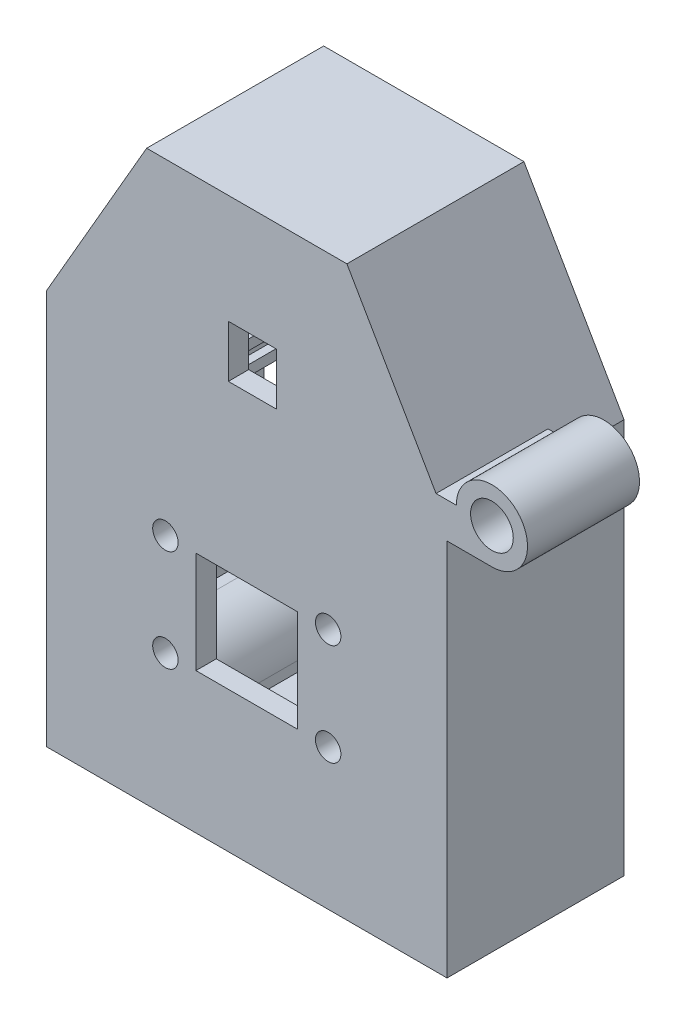
from build123d import *
from build123d.topology import SkipClean

# Parameters (mm, degrees)
BOSS_EXTRUDE1_DEPTH = 22.098
SKETCH11_R          = 1.5875
CUT_EXTRUDE7_DEPTH  = 33.02
CUT_EXTRUDE8_DEPTH  = 2.54
BOSS_EXTRUDE5_DEPTH = 2.54
BOSS_EXTRUDE6_DEPTH = 7.5
SKETCH14_R          = 1.5875
SKETCH14_W          = 12.7
SKETCH14_H          = 12.7
CUT_EXTRUDE9_DEPTH  = 2.54
SKETCH20_W          = 6
SKETCH20_H          = 6.5
CUT_EXTRUDE13_DEPTH = 7.5
SKETCH22_R          = 2.667
BOSS_EXTRUDE7_DEPTH = 13.97999998
SKETCH24_R          = 1.5875
BOSS_EXTRUDE9_DEPTH = 2.54


with BuildPart() as part:
    # Sketch1 → Boss-Extrude1 (new body)
    with BuildSketch(Plane.XY):
        Polygon((-25, 25.4), (-25, -23.909999932), (25, -23.909999932), (25, 25.4), (12.5, 47.050635095), (-12.5, 47.050635095), align=None)
    extrude(amount=BOSS_EXTRUDE1_DEPTH)

    # Sketch11 → Cut-Extrude7 (cut)
    with BuildSketch(Plane.XY.offset(22.098)):
        with BuildLine():
            Line((-18.015, 22.179409051), (-19.92, 22.179409051))
            Line((-19.92, 22.179409051), (-19.92, -11.209999932))
            Line((-19.92, -11.209999932), (-18.65, -11.209999932))
            ThreePointArc((-18.65, -11.209999932), (-14.159871939, -13.069871871), (-12.3, -17.559999932))
            Line((-12.3, -17.559999932), (-12.3, -18.829999932))
            Line((-12.3, -18.829999932), (12.3, -18.829999932))
            Line((12.3, -18.829999932), (12.3, -17.559999932))
            ThreePointArc((12.3, -17.559999932), (14.159871939, -13.069871871), (18.65, -11.209999932))
            Line((18.65, -11.209999932), (19.92, -11.209999932))
            Line((19.92, -11.209999932), (19.92, 24.038818102))
            Line((19.92, 24.038818102), (18.060590949, 27.259409051))
            Line((18.060590949, 27.259409051), (9.567060633, 41.970635095))
            Line((9.567060633, 41.970635095), (-9.567060633, 41.970635095))
            Line((-9.567060633, 41.970635095), (-18.060590949, 27.259409051))
            Line((-18.060590949, 27.259409051), (-18.015, 27.259409051))
            ThreePointArc((-18.015, 27.259409051), (-12.935, 24.719409051), (-18.015, 22.179409051))
        make_face()
        with Locations((-16.11, 24.719409051)):
            Circle(SKETCH11_R)
        with Locations((16.11, -15.02)):
            Circle(SKETCH11_R)
        with Locations((-16.11, -15.02)):
            Circle(SKETCH11_R)
    extrude(amount=-CUT_EXTRUDE7_DEPTH, mode=Mode.SUBTRACT)

    # Sketch12 → Cut-Extrude8 (cut)
    with BuildSketch(Plane(origin=(0, 0, 0), x_dir=(-1, 0, 0), z_dir=(0, 0, -1))):
        Polygon((-22.46, 25.4), (-22.46, -21.369999932), (22.46, -21.369999932), (22.46, 25.4), (11.23, 44.850930569), (-11.23, 44.850930569), align=None)
    extrude(amount=-CUT_EXTRUDE8_DEPTH, mode=Mode.SUBTRACT)

    # Sketch13 → Boss-Extrude5 (add)
    with BuildSketch(Plane.XY.offset(22.098)):
        Polygon((-25, 25.4), (-25, -23.909999932), (25, -23.909999932), (25, 25.4), (12.5, 47.050635095), (-12.5, 47.050635095), align=None)
    extrude(amount=-BOSS_EXTRUDE5_DEPTH)

    # Sketch19 → Boss-Extrude6 (add)
    with BuildSketch(Plane(origin=(0, 0, 19.558), x_dir=(-1, 0, 0), z_dir=(0, 0, -1))):
        Polygon((-11.968279908, 28.961226002), (-11.968279908, 24.921226002), (-9.698279908, 24.921226002), (-9.698279908, 26.191226002), (-10.698279908, 26.191226002), (-10.698279908, 27.691226002), (-9.698279908, 27.691226002), (-9.698279908, 28.961226002), align=None)
        Polygon((4.601720092, 27.691226002), (4.601720092, 26.191226002), (3.601720092, 26.191226002), (3.601720092, 24.921226002), (5.871720092, 24.921226002), (5.871720092, 28.961226002), (3.601720092, 28.961226002), (3.601720092, 27.691226002), align=None)
    extrude(amount=BOSS_EXTRUDE6_DEPTH)

    # Sketch14 → Cut-Extrude9 (cut)
    with BuildSketch(Plane(origin=(0, 0, 19.558), x_dir=(-1, 0, 0), z_dir=(0, 0, -1))):
        with Locations((-10.16, 6.35)):
            Circle(SKETCH14_R)
        with Locations((10.16, 6.35)):
            Circle(SKETCH14_R)
        with Locations((10.16, -6.35)):
            Circle(SKETCH14_R)
        with Locations((-10.16, -6.35)):
            Circle(SKETCH14_R)
        Rectangle(SKETCH14_W, SKETCH14_H)
    extrude(amount=-CUT_EXTRUDE9_DEPTH, mode=Mode.SUBTRACT)

    # Sketch20 → Cut-Extrude13 (cut)
    with BuildSketch(Plane(origin=(0, 0, 19.558), x_dir=(-1, 0, 0), z_dir=(0, 0, -1))):
        with Locations((-0.698279908, 30.191226002)):
            Rectangle(SKETCH20_W, SKETCH20_H)
    extrude(amount=-CUT_EXTRUDE13_DEPTH, mode=Mode.SUBTRACT)

    # Sketch22 → Boss-Extrude7 (add)
    with BuildSketch(Plane.XY.offset(22.098)):
        with BuildLine():
            Line((26.155685571, 27.78125), (23.625184671, 27.78125))
            Line((23.625184671, 27.78125), (25, 25.4))
            Line((25, 25.4), (25, 23.33625))
            Line((25, 23.33625), (30.600685571, 23.33625))
            ThreePointArc((30.600685571, 23.33625), (33.743775214, 30.924339642), (26.155685571, 27.78125))
        make_face()
        with Locations((30.600685571, 27.78125)):
            Circle(SKETCH22_R, mode=Mode.SUBTRACT)
    extrude(amount=-BOSS_EXTRUDE7_DEPTH)

    # Sketch24 → Boss-Extrude9 (add)
    with SkipClean():  # the faces are left unmerged after this step: merging them gives an invalid solid
        with BuildSketch(Plane(origin=(0, 0, 2.54), x_dir=(-1, 0, 0), z_dir=(0, 0, -1))):
            Polygon((11.23, 44.850930569), (-11.23, 44.850930569), (-22.46, 25.4), (-22.46, -21.369999932), (22.46, -21.369999932), (22.46, 25.4), align=None)
            with Locations((-16.11, -15.02)):
                Circle(SKETCH24_R, mode=Mode.SUBTRACT)
            with Locations((16.11, -15.02)):
                Circle(SKETCH24_R, mode=Mode.SUBTRACT)
            with BuildLine():
                Line((-19.92, 24.038818102), (-9.567060633, 41.970635095))
                Line((-9.567060633, 41.970635095), (9.567060633, 41.970635095))
                Line((9.567060633, 41.970635095), (18.060590949, 27.259409051))
                Line((18.060590949, 27.259409051), (18.015, 27.259409051))
                ThreePointArc((18.015, 27.259409051), (12.935, 24.719409051), (18.015, 22.179409051))
                Line((18.015, 22.179409051), (19.92, 22.179409051))
                Line((19.92, 22.179409051), (19.92, -11.209999932))
                Line((19.92, -11.209999932), (18.65, -11.209999932))
                ThreePointArc((18.65, -11.209999932), (14.159871939, -13.069871871), (12.3, -17.559999932))
                Line((12.3, -17.559999932), (12.3, -18.829999932))
                Line((12.3, -18.829999932), (-12.3, -18.829999932))
                Line((-12.3, -18.829999932), (-12.3, -17.559999932))
                ThreePointArc((-12.3, -17.559999932), (-14.159871939, -13.069871871), (-18.65, -11.209999932))
                Line((-18.65, -11.209999932), (-19.92, -11.209999932))
                Line((-19.92, -11.209999932), (-19.92, 24.038818102))
            make_face(mode=Mode.SUBTRACT)
            with Locations((16.11, 24.719409051)):
                Circle(SKETCH24_R, mode=Mode.SUBTRACT)
        extrude(amount=BOSS_EXTRUDE9_DEPTH)


solid = part.part
